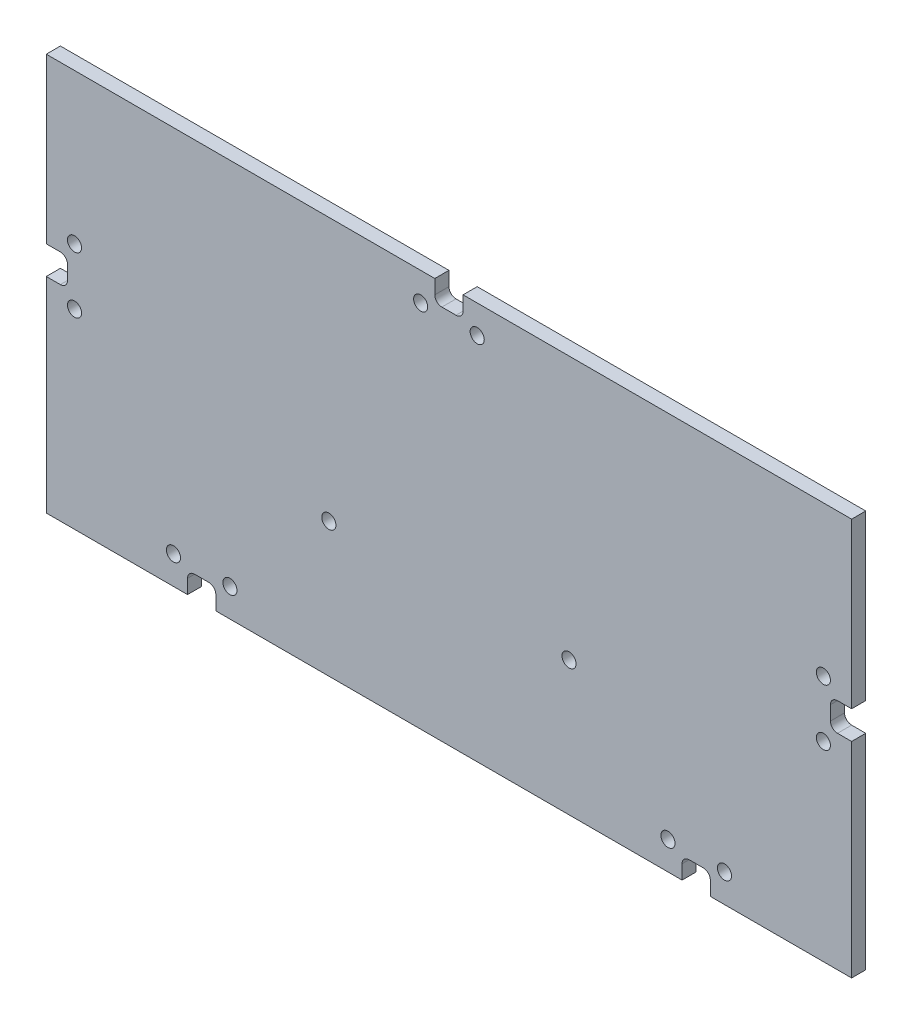
from build123d import *

# Parameters (mm, degrees)
SKETCH_1_R          = 1
EXTRUDE_1_DEPTH     = 2
SKETCH_2_R          = 1
CUT_EXTRUDE_1_DEPTH = 10


with BuildPart() as part:
    # 草圖1 → 填料-伸長1 (new body)
    with BuildSketch(Plane.XY):
        with BuildLine():
            Line((23.861531606, 13.243524775), (25.861531606, 13.243524775))
            ThreePointArc((25.861531606, 13.243524775), (26.568638387, 13.536417994), (26.861531606, 14.243524775))
            Line((26.861531606, 14.243524775), (26.861531606, 16.243524775))
            Line((26.861531606, 16.243524775), (80.861531606, 16.243524775))
            Line((80.861531606, 16.243524775), (81.861531606, 16.243524775))
            Line((81.861531606, 16.243524775), (81.861531606, 15.243524775))
            Line((81.861531606, 15.243524775), (81.861531606, -7.006475225))
            Line((81.861531606, -7.006475225), (79.861531606, -7.006475225))
            ThreePointArc((79.861531606, -7.006475225), (79.154424825, -7.299368444), (78.861531606, -8.006475225))
            Line((78.861531606, -8.006475225), (78.861531606, -10.006475225))
            ThreePointArc((78.861531606, -10.006475225), (79.154424825, -10.713582006), (79.861531606, -11.006475225))
            Line((79.861531606, -11.006475225), (81.861531606, -11.006475225))
            Line((81.861531606, -11.006475225), (81.861531606, -39.006475225))
            Line((81.861531606, -39.006475225), (81.861531606, -40.006475225))
            Line((81.861531606, -40.006475225), (80.861531606, -40.006475225))
            Line((80.861531606, -40.006475225), (61.861531606, -40.006475225))
            Line((61.861531606, -40.006475225), (61.861531606, -38.006475225))
            ThreePointArc((61.861531606, -38.006475225), (61.568638387, -37.299368444), (60.861531606, -37.006475225))
            Line((60.861531606, -37.006475225), (58.861531606, -37.006475225))
            ThreePointArc((58.861531606, -37.006475225), (58.154424825, -37.299368444), (57.861531606, -38.006475225))
            Line((57.861531606, -38.006475225), (57.861531606, -40.006475225))
            Line((57.861531606, -40.006475225), (-8.138468394, -40.006475225))
            Line((-8.138468394, -40.006475225), (-8.138468394, -38.006475225))
            ThreePointArc((-8.138468394, -38.006475225), (-8.431361613, -37.299368444), (-9.138468394, -37.006475225))
            Line((-9.138468394, -37.006475225), (-11.138468394, -37.006475225))
            ThreePointArc((-11.138468394, -37.006475225), (-11.845575175, -37.299368444), (-12.138468394, -38.006475225))
            Line((-12.138468394, -38.006475225), (-12.138468394, -40.006475225))
            Line((-12.138468394, -40.006475225), (-31.138468394, -40.006475225))
            Line((-31.138468394, -40.006475225), (-32.138468394, -40.006475225))
            Line((-32.138468394, -40.006475225), (-32.138468394, -39.006475225))
            Line((-32.138468394, -39.006475225), (-32.138468394, -11.006475225))
            Line((-32.138468394, -11.006475225), (-30.138468394, -11.006475225))
            ThreePointArc((-30.138468394, -11.006475225), (-29.431361613, -10.713582006), (-29.138468394, -10.006475225))
            Line((-29.138468394, -10.006475225), (-29.138468394, -8.006475225))
            ThreePointArc((-29.138468394, -8.006475225), (-29.431361613, -7.299368444), (-30.138468394, -7.006475225))
            Line((-30.138468394, -7.006475225), (-32.138468394, -7.006475225))
            Line((-32.138468394, -7.006475225), (-32.138468394, 15.243524775))
            Line((-32.138468394, 15.243524775), (-32.138468394, 16.243524775))
            Line((-32.138468394, 16.243524775), (-31.138468394, 16.243524775))
            Line((-31.138468394, 16.243524775), (22.861531606, 16.243524775))
            Line((22.861531606, 16.243524775), (22.861531606, 14.243524775))
            ThreePointArc((22.861531606, 14.243524775), (23.154424825, 13.536417994), (23.861531606, 13.243524775))
        make_face()
        with Locations((55.861531606, -36.006475225)):
            Circle(SKETCH_1_R, mode=Mode.SUBTRACT)
        with Locations((77.861531606, -5.006475225)):
            Circle(SKETCH_1_R, mode=Mode.SUBTRACT)
        with Locations((-6.138468394, -36.006475225)):
            Circle(SKETCH_1_R, mode=Mode.SUBTRACT)
        with Locations((28.861531606, 12.243524775)):
            Circle(SKETCH_1_R, mode=Mode.SUBTRACT)
        with Locations((20.861531606, 12.243524775)):
            Circle(SKETCH_1_R, mode=Mode.SUBTRACT)
        with Locations((-28.138468394, -5.006475225)):
            Circle(SKETCH_1_R, mode=Mode.SUBTRACT)
        with Locations((-28.138468394, -13.006475225)):
            Circle(SKETCH_1_R, mode=Mode.SUBTRACT)
        with Locations((77.861531606, -13.006475225)):
            Circle(SKETCH_1_R, mode=Mode.SUBTRACT)
        with Locations((-14.138468394, -36.006475225)):
            Circle(SKETCH_1_R, mode=Mode.SUBTRACT)
        with Locations((63.861531606, -36.006475225)):
            Circle(SKETCH_1_R, mode=Mode.SUBTRACT)
    extrude(amount=EXTRUDE_1_DEPTH)

    # 草圖2 → 除料-伸長1 (cut)
    with BuildSketch(Plane.XY.offset(2)):
        with Locations((7.861531606, -21.006475225)):
            Circle(SKETCH_2_R)
        with Locations((41.861531606, -21.006475225)):
            Circle(SKETCH_2_R)
    extrude(amount=-CUT_EXTRUDE_1_DEPTH, mode=Mode.SUBTRACT)


solid = part.part
